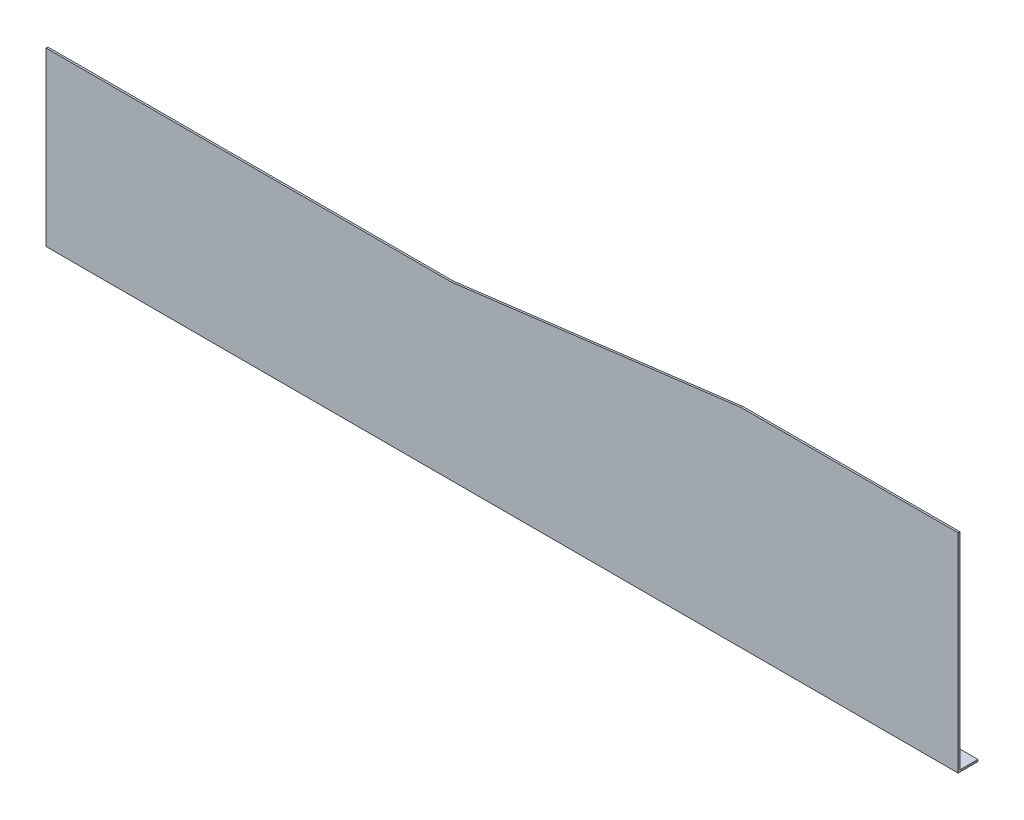
from build123d import *

# Parameters (mm, degrees)
BOSS_EXTRUDE1_DEPTH = 1.27
SKETCH2_W           = 630
SKETCH2_H           = 1.27
BOSS_EXTRUDE2_DEPTH = 13.77


with BuildPart() as part:
    # Sketch1 → Boss-Extrude1 (new body)
    with BuildSketch(Plane.XY):
        Polygon((0, 0), (0, 118.73), (280, 118.73), (480, 143.73), (630, 143.73), (630, 0), align=None)
    extrude(amount=BOSS_EXTRUDE1_DEPTH)

    # Sketch2 → Boss-Extrude2 (add)
    with BuildSketch(Plane.XY.offset(1.27)):
        with Locations((315, 0.635)):
            Rectangle(SKETCH2_W, SKETCH2_H)
    extrude(amount=-BOSS_EXTRUDE2_DEPTH)


solid = part.part
